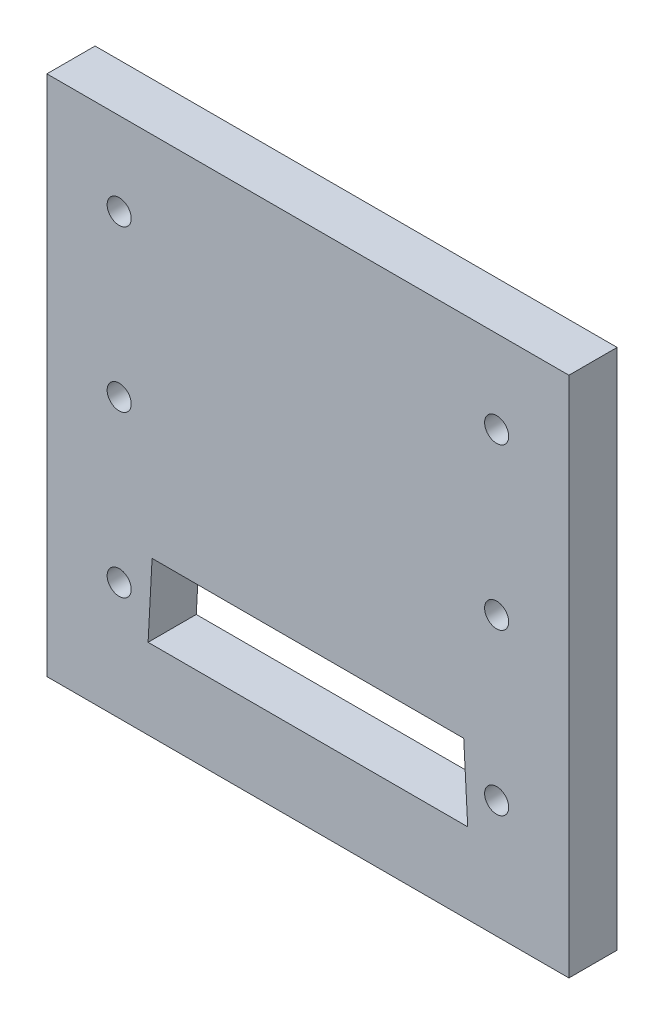
from build123d import *

# Parameters (mm, degrees)
SKETCH1_W           = 65
SKETCH1_H           = 65
SKETCH1_R           = 1.5
BOSS_EXTRUDE1_DEPTH = 6


with BuildPart() as part:
    # Sketch1 → Boss-Extrude1 (new body)
    with BuildSketch(Plane.XY):
        with Locations((19.9, 22.5)):
            Rectangle(SKETCH1_W, SKETCH1_H)
        with Locations((-3.6, 4.65)):
            Circle(SKETCH1_R, mode=Mode.SUBTRACT)
        with Locations((43.4, 4.65)):
            Circle(SKETCH1_R, mode=Mode.SUBTRACT)
        with Locations((-3.6, 24.65)):
            Circle(SKETCH1_R, mode=Mode.SUBTRACT)
        with Locations((43.4, 24.65)):
            Circle(SKETCH1_R, mode=Mode.SUBTRACT)
        with Locations((-3.6, 44.65)):
            Circle(SKETCH1_R, mode=Mode.SUBTRACT)
        with Locations((43.4, 44.65)):
            Circle(SKETCH1_R, mode=Mode.SUBTRACT)
        Polygon((0, 0), (39.8, 0), (39.3, 9.3), (0.5, 9.3), align=None, mode=Mode.SUBTRACT)
    extrude(amount=BOSS_EXTRUDE1_DEPTH)


solid = part.part
